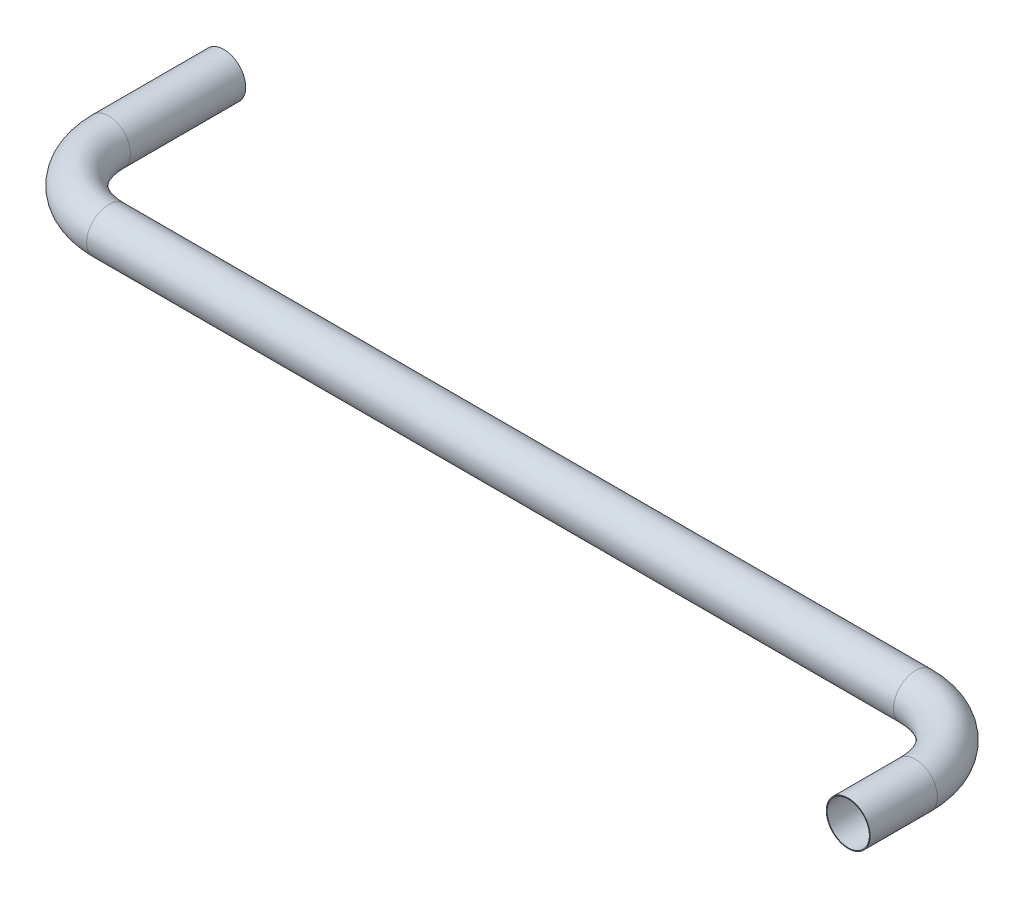
from build123d import *

# Parameters (mm, degrees)
SKETCH2_R   = 45.59
SKETCH2_R_2 = 44.09


with BuildPart() as part:
    # Sweep1: sweep along a path in Sketch1
    with BuildLine(Plane(origin=(0, 0, 0), x_dir=(1, 0, 0), z_dir=(0, 1, 0))) as sweep1_path:
        Line((0, 0), (0, 140))
        ThreePointArc((0, 140), (-46.86291501, 253.13708499), (-160, 300))
        Line((-160, 300), (-1840, 300))
        ThreePointArc((-1840, 300), (-1953.13708499, 346.86291501), (-2000, 460))
        Line((-2000, 460), (-2000, 700))
    # Sketch2 → Sweep1 (sweep)
    with BuildSketch(Plane.XY):
        Circle(SKETCH2_R)
        Circle(SKETCH2_R_2, mode=Mode.SUBTRACT)
    sweep(path=sweep1_path.line)


solid = part.part
